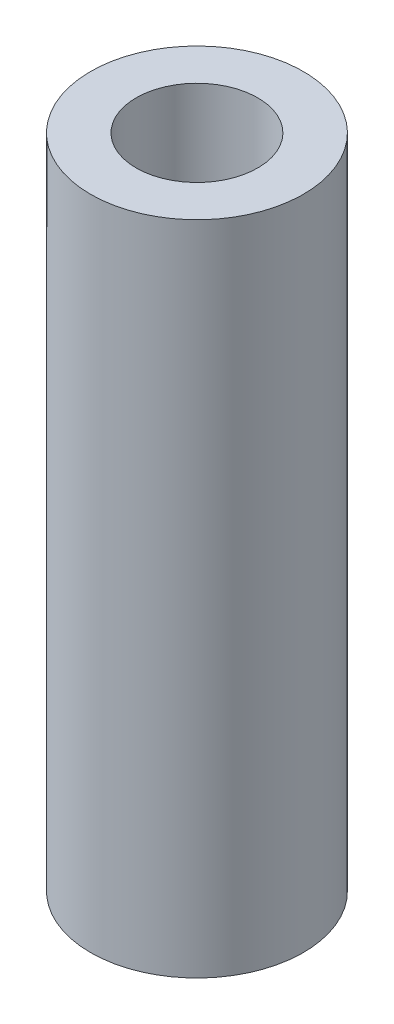
from build123d import *

# Parameters (mm, degrees)
SKETCH1_R           = 4.445
SKETCH1_R_2         = 2.54
BOSS_EXTRUDE1_DEPTH = 27.432


with BuildPart() as part:
    # Sketch1 → Boss-Extrude1 (new body)
    with BuildSketch(Plane(origin=(0, 0, 0), x_dir=(1, 0, 0), z_dir=(0, 1, 0))):
        with Locations(Location((0, 0, 0), (0, 0, 270))):
            Circle(SKETCH1_R)
        with Locations(Location((0, 0, 0), (0, 0, 270))):
            Circle(SKETCH1_R_2, mode=Mode.SUBTRACT)
    extrude(amount=BOSS_EXTRUDE1_DEPTH)


solid = part.part
